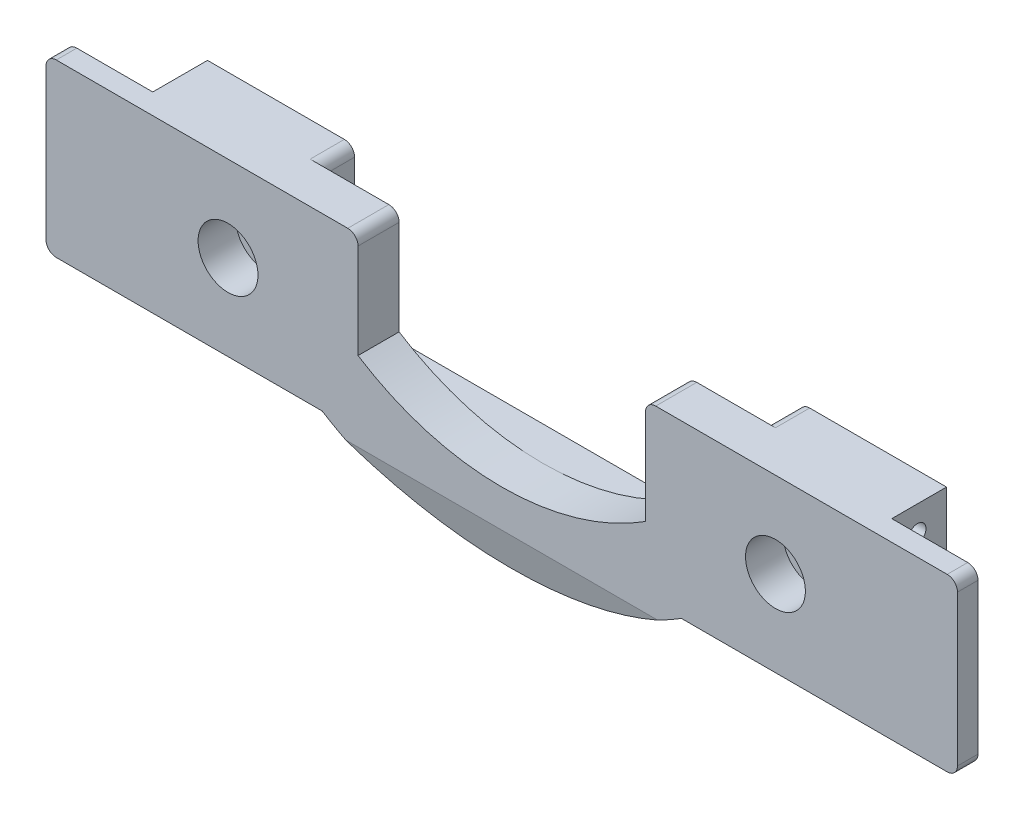
from build123d import *

# Parameters (mm, degrees)
SKETCH_1_W                = 266.4
SKETCH_1_H                = 50
EXTRUDE_1_DEPTH           = 22
SKETCH_2_W                = 25.2
SKETCH_2_H                = 16
CUT_EXTRUDE_1_DEPTH       = 144.966107122
SKETCH_5_W                = 130
SKETCH_5_H                = 43
CUT_EXTRUDE_4_DEPTH       = 10
CUT_EXTRUDE_2_DEPTH       = 138.299817917
EXTRUDE_2_DEPTH           = 22
CUT_EXTRUDE_5_DEPTH       = 250
HOLE_WIZARD_1_D           = 11
HOLE_WIZARD_1_DEPTH       = 100
HOLE_WIZARD_1_CBORE_D     = 17.5
HOLE_WIZARD_1_CBORE_DEPTH = 11
SKETCH_10_R               = 10
CUT_EXTRUDE_6_DEPTH       = 2
M6X1_0_1_AT_2_COUNT       = 2
M6X1_0_1_AT_2_PITCH       = 35
FILLET_1_R                = 3


with BuildPart() as part:
    # 草图1 → 凸台-拉伸1 (new body)
    with BuildSketch(Plane.XY):
        Rectangle(SKETCH_1_W, SKETCH_1_H)
    extrude(amount=-EXTRUDE_1_DEPTH)

    # 草图2 → 切除-拉伸1 (cut, through all)
    with BuildSketch(Plane(origin=(0, 25, 0), x_dir=(1, 0, 0), z_dir=(0, 1, 0))):
        with Locations((-120.6, 14)):
            Rectangle(SKETCH_2_W, SKETCH_2_H)
        with Locations((120.6, 14)):
            Rectangle(SKETCH_2_W, SKETCH_2_H)
    extrude(amount=-CUT_EXTRUDE_1_DEPTH, mode=Mode.SUBTRACT)

    # 草图5 → 切除-拉伸4 (cut)
    with BuildSketch(Plane(origin=(0, 0, -22), x_dir=(-1, 0, 0), z_dir=(0, 0, -1))):
        with Locations((0, 3.5)):
            Rectangle(SKETCH_5_W, SKETCH_5_H)
    extrude(amount=-CUT_EXTRUDE_4_DEPTH, mode=Mode.SUBTRACT)

    # 草图3 → 切除-拉伸2 (cut, through all)
    with BuildSketch(Plane.XY):
        with BuildLine():
            Line((-42, 25), (-42, -5.726706901))
            ThreePointArc((-42, -5.726706901), (0, -18), (42, -5.726706901))
            Line((42, -5.726706901), (42, 25))
            Line((42, 25), (-42, 25))
        make_face()
    extrude(amount=-CUT_EXTRUDE_2_DEPTH, mode=Mode.SUBTRACT)

    # 草图6 → 凸台-拉伸2 (add)
    with BuildSketch(Plane.XY):
        with BuildLine():
            Line((-52.5, -25), (52.5, -25))
            ThreePointArc((52.5, -25), (0, -39.889777347), (-52.5, -25))
        make_face()
    extrude(amount=-EXTRUDE_2_DEPTH)

    # 草图7 → 切除-拉伸5 (cut, symmetric)
    with BuildSketch(Plane(origin=(0, 0, 0), x_dir=(0, 0, -1), z_dir=(1, 0, 0))):
        Polygon((22, -39.889777347), (22, -26.889777347), (9, -39.889777347), align=None)
        Polygon((0, -39.889777347), (2.7, -39.889777347), (0, -28.889777347), align=None)
    extrude(amount=CUT_EXTRUDE_5_DEPTH, both=True, mode=Mode.SUBTRACT)

    # 孔1
    with Locations(Plane.XY):
        with Locations((80, 0), (-80, 0)):
            CounterBoreHole(HOLE_WIZARD_1_D / 2, HOLE_WIZARD_1_CBORE_D / 2, HOLE_WIZARD_1_CBORE_DEPTH, depth=HOLE_WIZARD_1_DEPTH)

    # 草图10 → 切除-拉伸6 (cut)
    with BuildSketch(Plane(origin=(0, 0, -22), x_dir=(-1, 0, 0), z_dir=(0, 0, -1))):
        with Locations((80, 0)):
            Circle(SKETCH_10_R)
        with Locations((-80, 0)):
            Circle(SKETCH_10_R)
    extrude(amount=-CUT_EXTRUDE_6_DEPTH, mode=Mode.SUBTRACT)

    # 草图11 → M6x1.0 螺纹孔1 (revolve, cut)
    with BuildSketch(Plane(origin=(-108, -17.5, -13.5), x_dir=(0, 0, 1), z_dir=(0, 1, 0))):
        Polygon((0, 0), (0, 16.502151548), (2.5, 15), (2.5, 0), align=None)
    m6x1_0_1 = revolve(axis=Axis((-114.35, -17.5, -13.5), (1, 0, 0)), mode=Mode.SUBTRACT)

    # M6x1.0 螺纹孔1 at 2: M6x1.0 螺纹孔1 ×2
    with Locations(*[(0, i * M6X1_0_1_AT_2_PITCH, 0) for i in range(1, M6X1_0_1_AT_2_COUNT)]):
        add(m6x1_0_1, mode=Mode.SUBTRACT)

    # 镜向1: M6x1.0 螺纹孔1 across plane
    add(m6x1_0_1.mirror(Plane(origin=(0, 0, 0), x_dir=(0, 0, 1), z_dir=(1, 0, 0))), mode=Mode.SUBTRACT)

    # 镜向1 copy 1 sketch → 镜向1 copy 1 (revolve, cut)
    with BuildSketch(Plane(origin=(108, 17.5, -13.5), x_dir=(0, 0, 1), z_dir=(0, 1, 0))):
        Polygon((0, 0), (0, -16.502151548), (2.5, -15), (2.5, 0), align=None)
    revolve(axis=Axis((114.35, 17.5, -13.5), (1, 0, 0)), mode=Mode.SUBTRACT)

    # 圆角1
    fillet_1_edges = [part.edges().sort_by_distance(p)[0] for p in [
        (-133.2, -25, -3),
        (-133.2, 25, -3),
        (133.2, -25, -3),
        (133.2, 25, -3),
        (65, -18, -17),
        (65, 25, -17),
        (-65, 25, -17),
        (-65, -18, -17),
        (-42, 25, -6),
        (42, 25, -6),
    ]]
    fillet(fillet_1_edges, radius=FILLET_1_R)


solid = part.part
